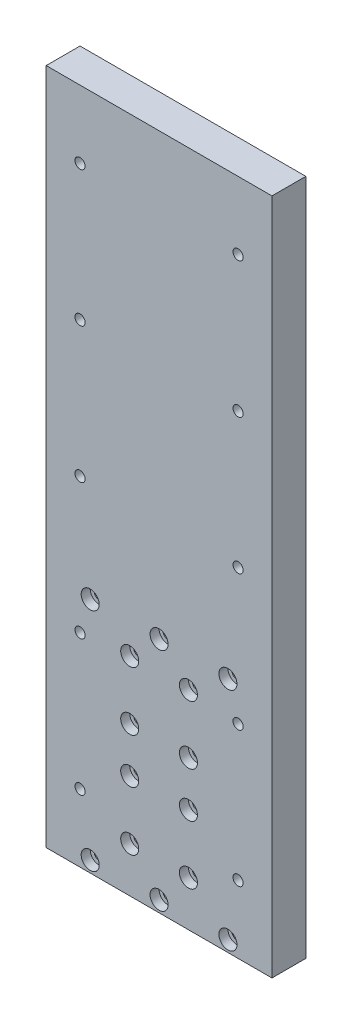
from build123d import *

# Parameters (mm, degrees)
SCHIZZO1_W                   = 100
SCHIZZO1_H                   = 300
ESTRUSIONE_ESTRUSIONE1_DEPTH = 15
SCHIZZO2_R                   = 2.25
TAGLIO_ESTRUSIONE1_DEPTH     = 317.583322366
SCHIZZO4_R                   = 4
TAGLIO_ESTRUSIONE2_DEPTH     = 4
SCHIZZO5_R                   = 2
TAGLIO_ESTRUSIONE3_DEPTH     = 317.583322366
FORO_PER_VITE_M4_1_D         = 4.5
FORO_PER_VITE_M4_1_DEPTH     = 10
FORO_PER_VITE_M4_1_TIP       = 1.351936393


with BuildPart() as part:
    # Schizzo1 → Estrusione-Estrusione1 (new body)
    with BuildSketch(Plane.XY):
        with Locations((50, 150)):
            Rectangle(SCHIZZO1_W, SCHIZZO1_H)
    extrude(amount=-ESTRUSIONE_ESTRUSIONE1_DEPTH)

    # Schizzo2 → Taglio-Estrusione1 (cut, through all)
    with BuildSketch(Plane.XY):
        with Locations((19.5, 105)):
            Circle(SCHIZZO2_R)
        with Locations((19.5, 5)):
            Circle(SCHIZZO2_R)
        with Locations((37, 20)):
            Circle(SCHIZZO2_R)
        with Locations((37, 46)):
            Circle(SCHIZZO2_R)
        with Locations((37, 66)):
            Circle(SCHIZZO2_R)
        with Locations((37, 92)):
            Circle(SCHIZZO2_R)
        with Locations((50, 105)):
            Circle(SCHIZZO2_R)
        with Locations((50, 5)):
            Circle(SCHIZZO2_R)
        with Locations(Location((63, 92, 0), (0, 0, 180))):
            Circle(SCHIZZO2_R)
        with Locations(Location((63, 66, 0), (0, 0, 180))):
            Circle(SCHIZZO2_R)
        with Locations(Location((63, 46, 0), (0, 0, 180))):
            Circle(SCHIZZO2_R)
        with Locations(Location((63, 20, 0), (0, 0, 180))):
            Circle(SCHIZZO2_R)
        with Locations(Location((80.5, 5, 0), (0, 0, 180))):
            Circle(SCHIZZO2_R)
        with Locations(Location((80.5, 105, 0), (0, 0, 180))):
            Circle(SCHIZZO2_R)
    extrude(amount=-TAGLIO_ESTRUSIONE1_DEPTH, mode=Mode.SUBTRACT)

    # Schizzo4 → Taglio-Estrusione2 (cut)
    with BuildSketch(Plane.XY):
        with Locations((19.5, 105)):
            Circle(SCHIZZO4_R)
        with Locations((50, 105)):
            Circle(SCHIZZO4_R)
        with Locations((80.5, 105)):
            Circle(SCHIZZO4_R)
        with Locations((37, 92)):
            Circle(SCHIZZO4_R)
        with Locations((63, 92)):
            Circle(SCHIZZO4_R)
        with Locations((37, 66)):
            Circle(SCHIZZO4_R)
        with Locations((63, 66)):
            Circle(SCHIZZO4_R)
        with Locations((37, 46)):
            Circle(SCHIZZO4_R)
        with Locations((63, 46)):
            Circle(SCHIZZO4_R)
        with Locations((19.5, 5)):
            Circle(SCHIZZO4_R)
        with Locations((37, 20)):
            Circle(SCHIZZO4_R)
        with Locations((63, 20)):
            Circle(SCHIZZO4_R)
        with Locations((50, 5)):
            Circle(SCHIZZO4_R)
        with Locations((80.5, 5)):
            Circle(SCHIZZO4_R)
    extrude(amount=-TAGLIO_ESTRUSIONE2_DEPTH, mode=Mode.SUBTRACT)

    # Schizzo5 → Taglio-Estrusione3 (cut, through all)
    with BuildSketch(Plane.XY):
        with Locations((85, 150)):
            Circle(SCHIZZO5_R)
        with Locations((85, 210)):
            Circle(SCHIZZO5_R)
        with Locations((85, 270)):
            Circle(SCHIZZO5_R)
        with Locations(Location((85, 30, 0), (0, 0, 180))):
            Circle(SCHIZZO5_R)
        with Locations(Location((85, 90, 0), (0, 0, 180))):
            Circle(SCHIZZO5_R)
        with Locations((15, 90)):
            Circle(SCHIZZO5_R)
        with Locations((15, 30)):
            Circle(SCHIZZO5_R)
        with Locations(Location((15, 270, 0), (0, 0, 180))):
            Circle(SCHIZZO5_R)
        with Locations(Location((15, 210, 0), (0, 0, 180))):
            Circle(SCHIZZO5_R)
        with Locations(Location((15, 150, 0), (0, 0, 180))):
            Circle(SCHIZZO5_R)
    extrude(amount=-TAGLIO_ESTRUSIONE3_DEPTH, mode=Mode.SUBTRACT)

    # Foro per Vite M4-1
    with Locations(Plane(origin=(15, 270, 0), x_dir=(1, 0, 0), z_dir=(0, 0, 1))):
        with Locations((0, 0), (70, 0), (0, -60), (70, -60), (0, -120), (70, -120), (0, -180), (70, -180), (0, -240), (70, -240)):
            Hole(FORO_PER_VITE_M4_1_D / 2, depth=FORO_PER_VITE_M4_1_DEPTH)
            with Locations((0, 0, -(FORO_PER_VITE_M4_1_DEPTH + FORO_PER_VITE_M4_1_TIP / 2))):  # 118° drill point
                Cone(0, FORO_PER_VITE_M4_1_D / 2, FORO_PER_VITE_M4_1_TIP, mode=Mode.SUBTRACT)


solid = part.part
